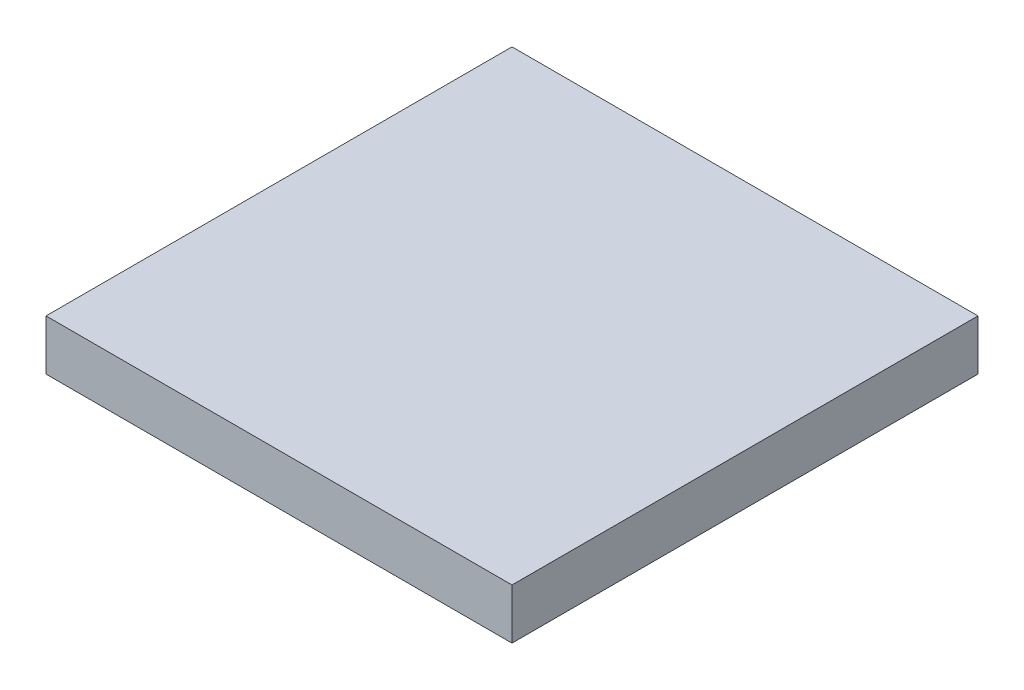
from build123d import *

# Parameters (mm, degrees)
SKETCH1_W           = 47.625
SKETCH1_H           = 47.625
BOSS_EXTRUDE1_DEPTH = 5.15


with BuildPart() as part:
    # Sketch1 → Boss-Extrude1 (new body)
    with BuildSketch(Plane(origin=(0, 0, 0), x_dir=(1, 0, 0), z_dir=(0, 1, 0))):
        with Locations((23.8125, 23.8125)):
            Rectangle(SKETCH1_W, SKETCH1_H)
    extrude(amount=BOSS_EXTRUDE1_DEPTH)


solid = part.part
